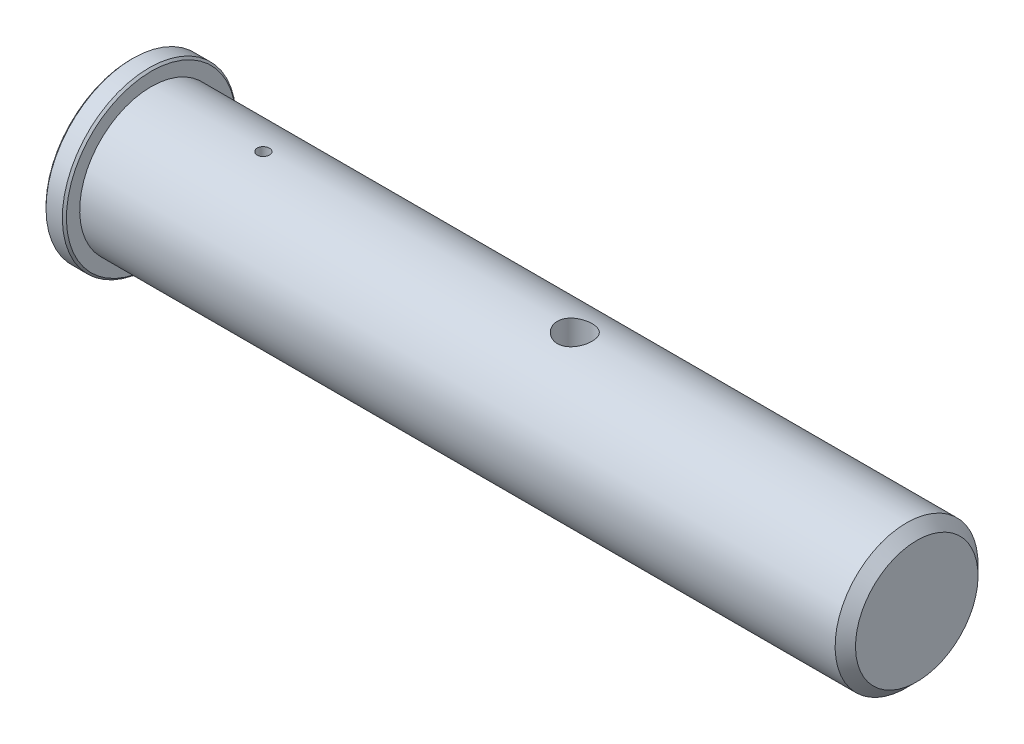
from build123d import *

# Parameters (mm, degrees)
CHAMFER_1_SIZE            = 1
HOLE_WIZARD_8_0_8_1_D     = 8
HOLE_WIZARD_8_0_8_1_DEPTH = 70
HOLE_WIZARD_8_0_8_1_TIP   = 2.403442476
CHAMFER_2_SIZE            = 5
M10X1_0_1_D               = 9
M10X1_0_1_DEPTH           = 15
M10X1_0_1_TIP             = 2.703872786
HOLE_WIZARD_6_0_6_4_D     = 6
HOLE_WIZARD_6_0_6_4_DEPTH = 35
HOLE_WIZARD_6_0_6_4_TIP   = 1.802581857
SKETCH_8_R                = 8.5
CUT_EXTRUDE_1_DEPTH       = 35


with BuildPart() as part:
    # 草图1 → 旋转1 (revolve)
    with BuildSketch(Plane.XY):
        Polygon((0, 0), (0, 42.5), (10, 42.5), (10, 35), (385, 35), (385, 0), align=None)
    revolve(axis=Axis((385, 0, 0), (-1, 0, 0)))

    # 倒角1
    chamfer_1_edges = [part.edges().sort_by_distance(p)[0] for p in [
        (10, -42.5, 0),
        (0, -42.5, 0),
    ]]
    chamfer(chamfer_1_edges, length=CHAMFER_1_SIZE)

    # Ø8.0 (8) 直径孔1
    with Locations(Plane(origin=(0, 0, 0), x_dir=(0, -1, 0), z_dir=(-1, 0, 0))):
        with Locations((0, 0)):
            Hole(HOLE_WIZARD_8_0_8_1_D / 2, depth=HOLE_WIZARD_8_0_8_1_DEPTH)
            with Locations((0, 0, -(HOLE_WIZARD_8_0_8_1_DEPTH + HOLE_WIZARD_8_0_8_1_TIP / 2))):  # 118° drill point
                Cone(0, HOLE_WIZARD_8_0_8_1_D / 2, HOLE_WIZARD_8_0_8_1_TIP, mode=Mode.SUBTRACT)

    # 倒角2
    chamfer_2_edges = [part.edges().sort_by_distance(p)[0] for p in [
        (385, -35, 0),
    ]]
    chamfer(chamfer_2_edges, length=CHAMFER_2_SIZE)

    # M10x1.0 螺纹孔1
    with Locations(Plane(origin=(0, 0, 0), x_dir=(0, -1, 0), z_dir=(-1, 0, 0))):
        with Locations((0, 0)):
            Hole(M10X1_0_1_D / 2, depth=M10X1_0_1_DEPTH)
            with Locations((0, 0, -(M10X1_0_1_DEPTH + M10X1_0_1_TIP / 2))):  # 118° drill point
                Cone(0, M10X1_0_1_D / 2, M10X1_0_1_TIP, mode=Mode.SUBTRACT)

    # Ø6.0 (6) 直径孔4
    with Locations(Plane(origin=(0, 35, 0), x_dir=(1, 0, 0), z_dir=(0, 1, 0))):
        with Locations((65, 0)):
            Hole(HOLE_WIZARD_6_0_6_4_D / 2, depth=HOLE_WIZARD_6_0_6_4_DEPTH)
            with Locations((0, 0, -(HOLE_WIZARD_6_0_6_4_DEPTH + HOLE_WIZARD_6_0_6_4_TIP / 2))):  # 118° drill point
                Cone(0, HOLE_WIZARD_6_0_6_4_D / 2, HOLE_WIZARD_6_0_6_4_TIP, mode=Mode.SUBTRACT)

    # 草图8 → 切除-拉伸1 (cut, symmetric)
    with BuildSketch(Plane(origin=(0, 0, 0), x_dir=(1, 0, 0), z_dir=(0, 1, 0))):
        with Locations((217.5, 0)):
            Circle(SKETCH_8_R)
    extrude(amount=CUT_EXTRUDE_1_DEPTH, both=True, mode=Mode.SUBTRACT)


solid = part.part
